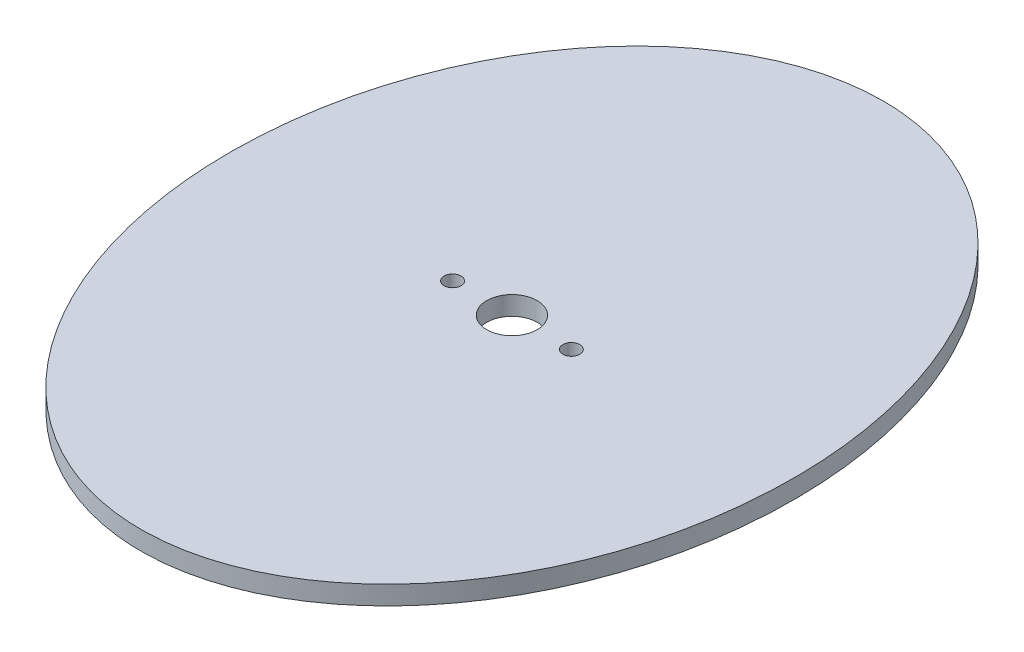
from build123d import *

# Parameters (mm, degrees)
SKETCH1_RX          = 62.5
SKETCH1_RY          = 47.5
BOSS_EXTRUDE1_DEPTH = 3.175
SKETCH2_R           = 4.25
SKETCH2_R_2         = 1.425
CUT_EXTRUDE1_DEPTH  = 79.565772605


with BuildPart() as part:
    # Sketch1 → Boss-Extrude1 (new body)
    with BuildSketch(Plane(origin=(0, 0, 0), x_dir=(1, 0, 0), z_dir=(0, 1, 0))):
        with Locations(Location((0, 0), (0, 0, 90))):
            Ellipse(SKETCH1_RX, SKETCH1_RY)
    extrude(amount=BOSS_EXTRUDE1_DEPTH)

    # Sketch2 → Cut-Extrude1 (cut, through all)
    with BuildSketch(Plane(origin=(0, 3.175, 0), x_dir=(1, 0, 0), z_dir=(0, 1, 0))):
        with Locations(Location((0, 0, 0), (0, 0, 270))):
            Circle(SKETCH2_R)
        with Locations(Location((-10, 0, 0), (0, 0, 270))):
            Circle(SKETCH2_R_2)
        with Locations(Location((10, 0, 0), (0, 0, 270))):
            Circle(SKETCH2_R_2)
    extrude(amount=-CUT_EXTRUDE1_DEPTH, mode=Mode.SUBTRACT)


solid = part.part
